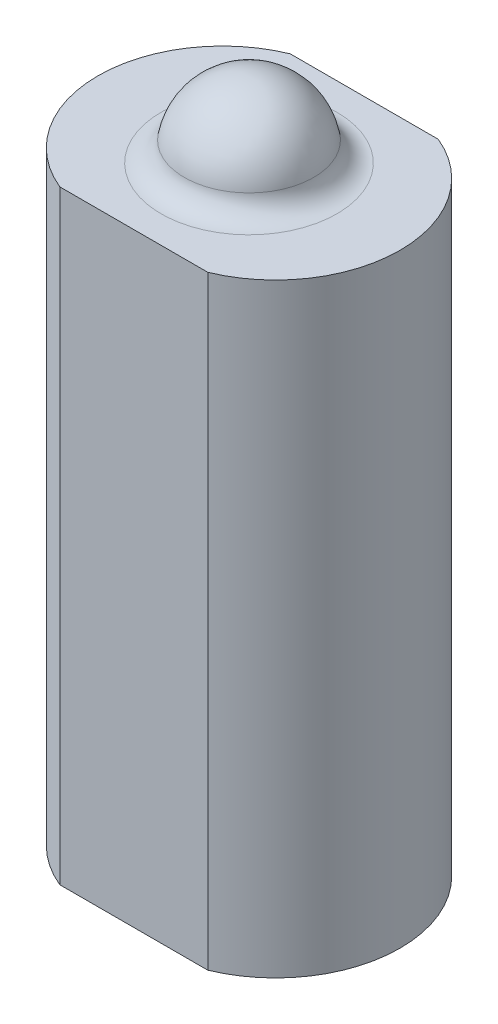
from build123d import *

# Parameters (mm, degrees)
BOSS_EXTRUDE1_DEPTH = 80


with BuildPart() as part:
    # Sketch1 → Boss-Extrude1 (new body)
    with BuildSketch(Plane(origin=(0, 0, 0), x_dir=(1, 0, 0), z_dir=(0, 1, 0))):
        with BuildLine():
            Line((-9.791248996, 15.25), (9.791248996, 15.25))
            ThreePointArc((9.791248996, 15.25), (20, 0), (9.791248996, -15.25))
            Line((9.791248996, -15.25), (-9.791248996, -15.25))
            ThreePointArc((-9.791248996, -15.25), (-20, 0), (-9.791248996, 15.25))
        make_face()
    extrude(amount=BOSS_EXTRUDE1_DEPTH)

    # Sketch4 → Revolve1 (revolve)
    with BuildSketch(Plane(origin=(0, 0, 0), x_dir=(0, 0, -1), z_dir=(1, 0, 0))):
        with BuildLine():
            Line((0, 80), (11.641855063, 80))
            ThreePointArc((11.641855063, 80), (9.61766545, 80.745389743), (8.560304848, 82.625532826))
            ThreePointArc((8.560304848, 82.625532826), (5.623040011, 87.848422876), (0, 89.919057131))
            Line((0, 89.919057131), (0, 80))
        make_face()
    revolve(axis=Axis((0, 80, 0), (0, 1, 0)))


solid = part.part
